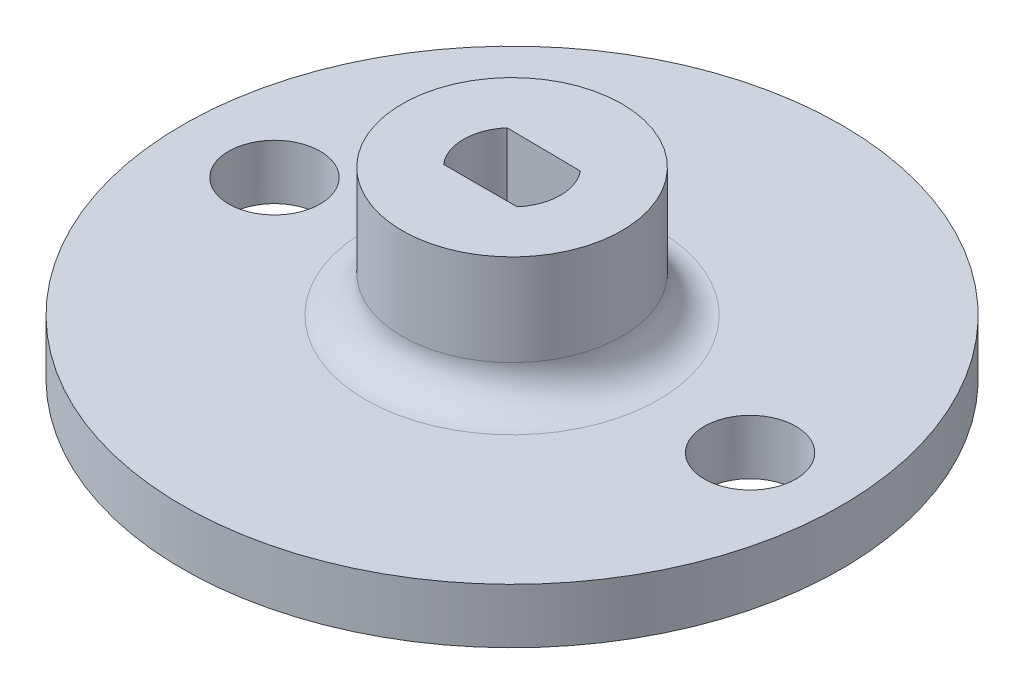
from build123d import *

# Parameters (mm, degrees)
SKETCH1_R           = 6
BOSS_EXTRUDE6_DEPTH = 7
SKETCH5_R           = 18
BOSS_EXTRUDE7_DEPTH = 3
CUT_EXTRUDE2_DEPTH  = 6
FILLET1_R           = 2
SKETCH8_R           = 2.5
CUT_EXTRUDE3_DEPTH  = 6
CUT_EXTRUDE4_DEPTH  = 8


with BuildPart() as part:
    # Sketch1 → Boss-Extrude6 (new body)
    with BuildSketch(Plane(origin=(0, 0, 0), x_dir=(1, 0, 0), z_dir=(0, 1, 0))):
        with Locations(Location((0, 0, 0), (0, 0, 270))):
            Circle(SKETCH1_R)
    extrude(amount=BOSS_EXTRUDE6_DEPTH)

    # Sketch5 → Boss-Extrude7 (add)
    with BuildSketch(Plane(origin=(0, 0, 0), x_dir=(-1, 0, 0), z_dir=(0, -1, 0))):
        with Locations(Location((0, 0, 0), (0, 0, 90))):
            Circle(SKETCH5_R)
    extrude(amount=BOSS_EXTRUDE7_DEPTH)

    # Sketch6 → Cut-Extrude2 (cut)
    with BuildSketch(Plane(origin=(0, 7, 0), x_dir=(1, 0, 0), z_dir=(0, 1, 0))):
        with BuildLine():
            Line((1.932582761, 1.5), (-1.932582761, 1.5))
            ThreePointArc((-1.932582761, 1.5), (-1.93394777, 1.498239684), (-1.935311176, 1.496478126))
            ThreePointArc((-1.935311176, 1.496478126), (-2.446399634, -0.002227546), (-1.932582761, -1.5))
            Line((-1.932582761, -1.5), (1.932582761, -1.5))
            ThreePointArc((1.932582761, -1.5), (2.446400648, 0), (1.932582761, 1.5))
        make_face()
    extrude(amount=-CUT_EXTRUDE2_DEPTH, mode=Mode.SUBTRACT)

    # Fillet1
    fillet1_edges = [part.edges().sort_by_distance(p)[0] for p in [
        (0, 0, -6),
    ]]
    fillet(fillet1_edges, radius=FILLET1_R)

    # Sketch8 → Cut-Extrude3 (cut)
    with BuildSketch(Plane(origin=(0, 0, 0), x_dir=(1, 0, 0), z_dir=(0, 1, 0))):
        with Locations(Location((13, 0, 0), (0, 0, 270))):
            Circle(SKETCH8_R)
        with Locations(Location((-13, 0.022078195, 0), (0, 0, 270))):
            Circle(SKETCH8_R)
    extrude(amount=-CUT_EXTRUDE3_DEPTH, mode=Mode.SUBTRACT)

    # Sketch9 → Cut-Extrude4 (cut)
    with BuildSketch(Plane(origin=(0, 7, 0), x_dir=(1, 0, 0), z_dir=(0, 1, 0))):
        with BuildLine():
            Line((-2.004154278, 1.733743242), (2.043845612, 1.686770617))
            ThreePointArc((2.043845612, 1.686770617), (2.649821606, -0.03074829), (2.004154278, -1.733743242))
            Line((2.004154278, -1.733743242), (-2.004154278, -1.733743242))
            ThreePointArc((-2.004154278, -1.733743242), (-2.65, 0), (-2.004154278, 1.733743242))
        make_face()
    extrude(amount=-CUT_EXTRUDE4_DEPTH, mode=Mode.SUBTRACT)


solid = part.part
